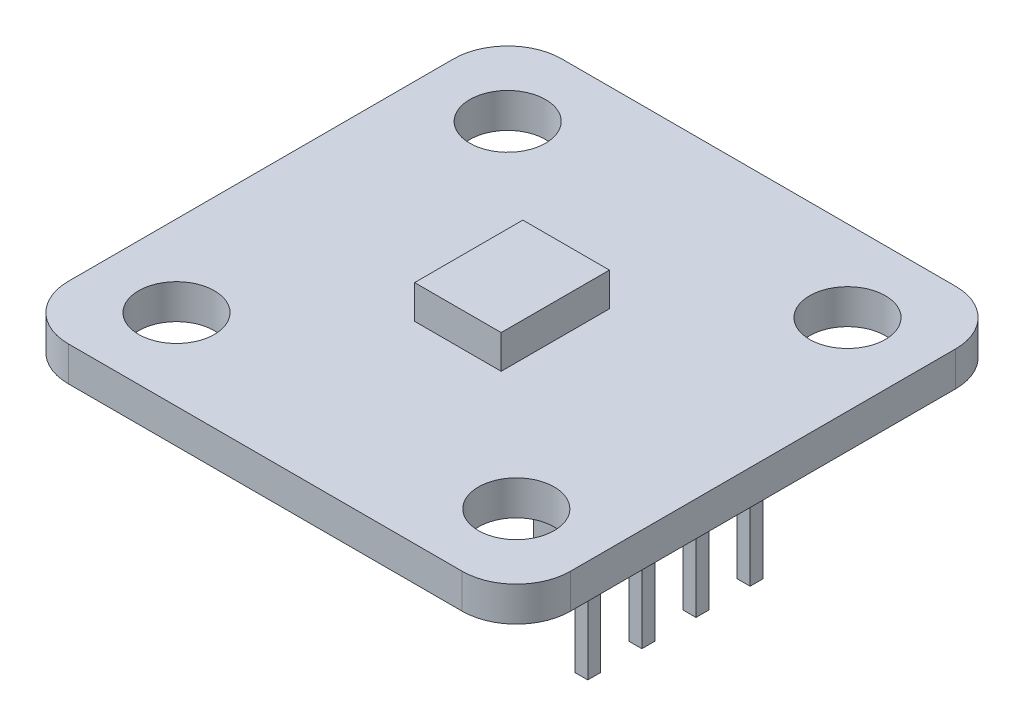
from build123d import *

# Parameters (mm, degrees)
SKETCH1_W           = 23.2
SKETCH1_H           = 22.8
SKETCH1_W_2         = 4
SKETCH1_H_2         = 5
BOSS_EXTRUDE1_DEPTH = 1.6
SKETCH1_4_W         = 4
SKETCH1_4_H         = 5
BOSS_EXTRUDE2_DEPTH = 3.15
FILLET1_R           = 2.5
SKETCH2_R           = 1.75
CUT_EXTRUDE1_DEPTH  = 3.1
SKETCH3_W           = 2.5
SKETCH3_H           = 10
SKETCH3_H_2         = 7.5
BOSS_EXTRUDE3_DEPTH = 2.6
SKETCH4_W           = 0.6
SKETCH4_H           = 0.6
BOSS_EXTRUDE4_DEPTH = 5


with BuildPart() as part:
    # Sketch1 → Boss-Extrude1 (new body)
    with BuildSketch(Plane(origin=(0, 0, 0), x_dir=(1, 0, 0), z_dir=(0, 1, 0))):
        Rectangle(SKETCH1_W, SKETCH1_H)
        Rectangle(SKETCH1_W_2, SKETCH1_H_2, mode=Mode.SUBTRACT)
    extrude(amount=BOSS_EXTRUDE1_DEPTH)

    # Sketch1<4> → Boss-Extrude2 (add)
    with BuildSketch(Plane(origin=(0, 0, 0), x_dir=(1, 0, 0), z_dir=(0, 1, 0))):
        Rectangle(SKETCH1_4_W, SKETCH1_4_H)
    extrude(amount=BOSS_EXTRUDE2_DEPTH)

    # Fillet1
    fillet1_edges = [part.edges().sort_by_distance(p)[0] for p in [
        (-11.6, 0.8, -11.4),
        (-11.6, 0.8, 11.4),
        (11.6, 0.8, -11.4),
        (11.6, 0.8, 11.4),
    ]]
    fillet(fillet1_edges, radius=FILLET1_R)

    # Sketch2 → Cut-Extrude1 (cut)
    with BuildSketch(Plane(origin=(0, 1.6, 0), x_dir=(1, 0, 0), z_dir=(0, 1, 0))):
        with Locations((-7.85, -7.65)):
            Circle(SKETCH2_R)
        with Locations((-7.85, 7.65)):
            Circle(SKETCH2_R)
        with Locations((7.85, -7.65)):
            Circle(SKETCH2_R)
        with Locations((7.85, 7.65)):
            Circle(SKETCH2_R)
    extrude(amount=-CUT_EXTRUDE1_DEPTH, mode=Mode.SUBTRACT)

    # Sketch3 → Boss-Extrude3 (add)
    with BuildSketch(Plane.XZ):
        with Locations((6.85, -0.4)):
            Rectangle(SKETCH3_W, SKETCH3_H)
        with Locations((-6.85, -0.15)):
            Rectangle(SKETCH3_W, SKETCH3_H_2)
    extrude(amount=BOSS_EXTRUDE3_DEPTH)

    # Sketch4 → Boss-Extrude4 (add)
    with BuildSketch(Plane.XZ.offset(2.6)):
        with Locations((-6.85, -0.15)):
            Rectangle(SKETCH4_W, SKETCH4_H)
        with Locations((-6.85, 2.35)):
            Rectangle(SKETCH4_W, SKETCH4_H)
        with Locations((-6.85, -2.65)):
            Rectangle(SKETCH4_W, SKETCH4_H)
        with Locations((6.85, 3.35)):
            Rectangle(SKETCH4_W, SKETCH4_H)
        with Locations((6.85, 0.85)):
            Rectangle(SKETCH4_W, SKETCH4_H)
        with Locations((6.85, -1.65)):
            Rectangle(SKETCH4_W, SKETCH4_H)
        with Locations((6.85, -4.15)):
            Rectangle(SKETCH4_W, SKETCH4_H)
    extrude(amount=BOSS_EXTRUDE4_DEPTH)


solid = part.part
